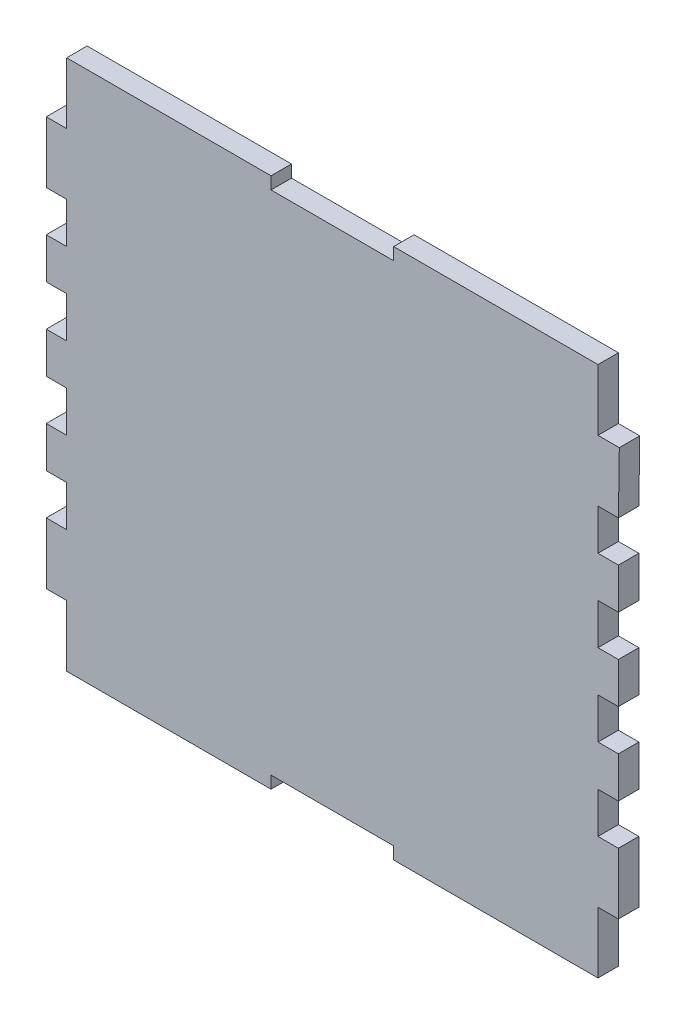
from build123d import *

# Parameters (mm, degrees)
BOSS_EXTRUDE2_DEPTH = 5


with BuildPart() as part:
    # Sketch1 → Boss-Extrude2 (new body)
    with BuildSketch(Plane.XY):
        Polygon((-44.808964075, -69.870541313), (-34.808964075, -69.870541313), (-24.808964075, -69.870541313), (-14.808964075, -69.870541313), (-14.808964075, -66.870541313), (15.191035925, -66.870541313), (15.191035925, -69.870541313), (25.191035925, -69.870541313), (35.191035925, -69.870541313), (45.191035925, -69.870541313), (55.191035925, -69.870541313), (65.191035925, -69.870541313), (65.191035925, -54.870541313), (70.191035925, -54.870541313), (70.191035925, -39.870541313), (65.191035925, -39.870541313), (65.191035925, -29.870541313), (70.191035925, -29.870541313), (70.191035925, -19.870541313), (65.191035925, -19.870541313), (65.191035925, -9.870541313), (70.191035925, -9.870541313), (70.191035925, 0.129458687), (65.191035925, 0.129458687), (65.191035925, 10.129458687), (70.191035925, 10.129458687), (70.191035925, 20.129458687), (65.191035925, 20.129458687), (65.191035925, 30.129458687), (70.191035925, 30.129458687), (70.407152599, 45.123402037), (65.191035925, 45.123402037), (65.191035925, 60.123402037), (55.191035925, 60.123402037), (45.191035925, 60.123402037), (35.191035925, 60.123402037), (25.191035925, 60.123402037), (15.191035925, 60.123402037), (15.191035925, 57.123402037), (-14.808964075, 57.123402037), (-14.808964075, 60.123402037), (-24.808964075, 60.123402037), (-34.808964075, 60.123402037), (-44.808964075, 60.123402037), (-54.808964075, 60.123402037), (-64.808964075, 60.123402037), (-64.808964075, 45.123402037), (-69.808964075, 45.123402037), (-69.808964075, 30.123402037), (-64.808964075, 30.129458687), (-64.808964075, 20.129458687), (-69.808964075, 20.129458687), (-69.808964075, 10.129458687), (-64.808964075, 10.129458687), (-64.808964075, 0.129458687), (-69.808964075, 0.129458687), (-69.808964075, -9.870541313), (-64.808964075, -9.870541313), (-64.808964075, -19.870541313), (-69.808964075, -19.870541313), (-69.808964075, -29.870541313), (-64.808964075, -29.870541313), (-64.808964075, -39.870541313), (-69.808964075, -39.870541313), (-69.808964075, -54.870541313), (-64.808964075, -54.870541313), (-64.808964075, -69.870541313), (-54.808964075, -69.870541313), align=None)
    extrude(amount=BOSS_EXTRUDE2_DEPTH)


solid = part.part
